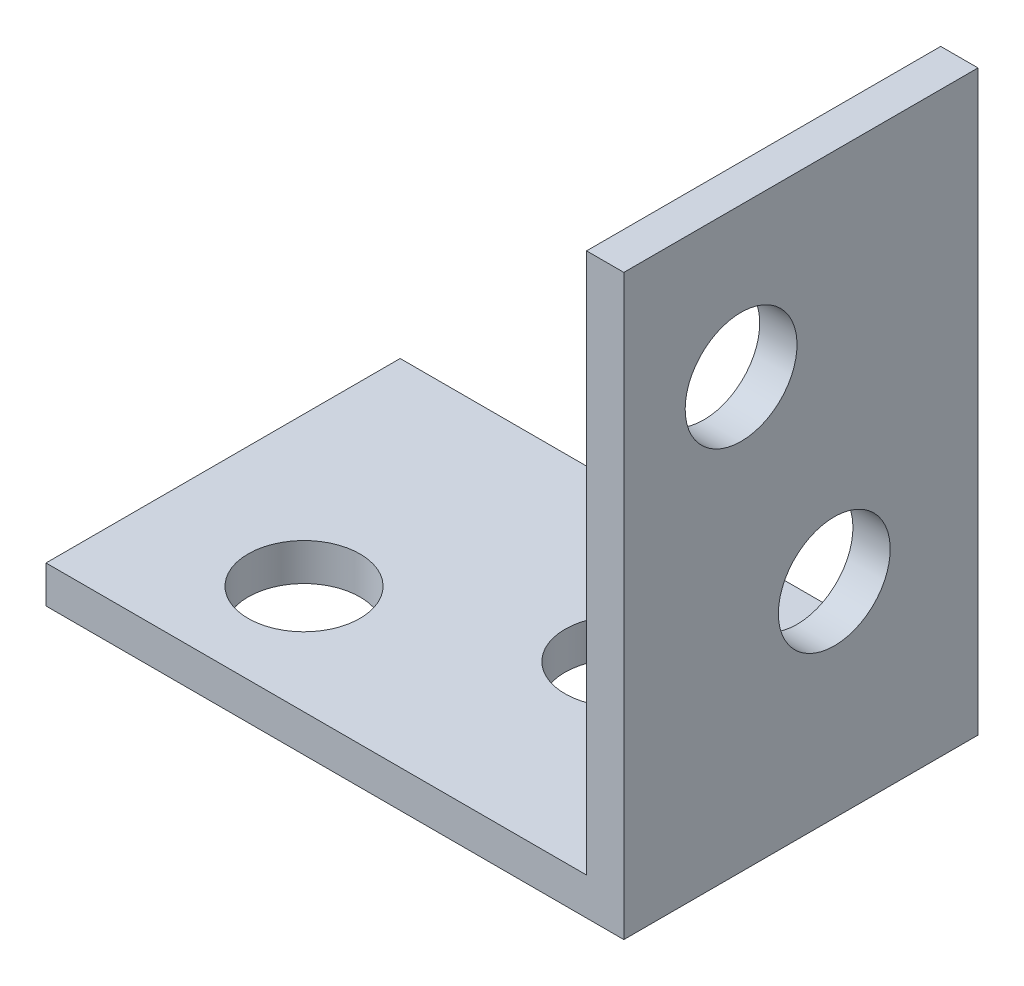
from build123d import *

# Parameters (mm, degrees)
EXTRUDE_1_DEPTH     = 19
SKETCH_2_R          = 3
CUT_EXTRUDE_1_DEPTH = 19
SKETCH_3_R          = 3
CUT_EXTRUDE_2_DEPTH = 19


with BuildPart() as part:
    # 草图1 → 凸台-拉伸1 (new body)
    with BuildSketch(Plane.XY):
        Polygon((0, 0), (31, 0), (31, 31), (29, 31), (29, 2), (0, 2), align=None)
    extrude(amount=EXTRUDE_1_DEPTH)

    # 草图2 → 切除-拉伸1 (cut)
    with BuildSketch(Plane.ZY.offset(-29)):
        with Locations(Location((7.709838353, 11, 0), (0, 0, 270))):
            Circle(SKETCH_2_R)
        with Locations(Location((12.709838353, 23, 0), (0, 0, 270))):
            Circle(SKETCH_2_R)
    extrude(amount=-CUT_EXTRUDE_1_DEPTH, mode=Mode.SUBTRACT)

    # 草图3 → 切除-拉伸2 (cut)
    with BuildSketch(Plane(origin=(0, 2, 0), x_dir=(1, 0, 0), z_dir=(0, 1, 0))):
        with Locations(Location((20, -8.156857101, 0), (0, 0, 180))):
            Circle(SKETCH_3_R)
        with Locations(Location((8, -13.156857101, 0), (0, 0, 180))):
            Circle(SKETCH_3_R)
    extrude(amount=-CUT_EXTRUDE_2_DEPTH, mode=Mode.SUBTRACT)


solid = part.part
